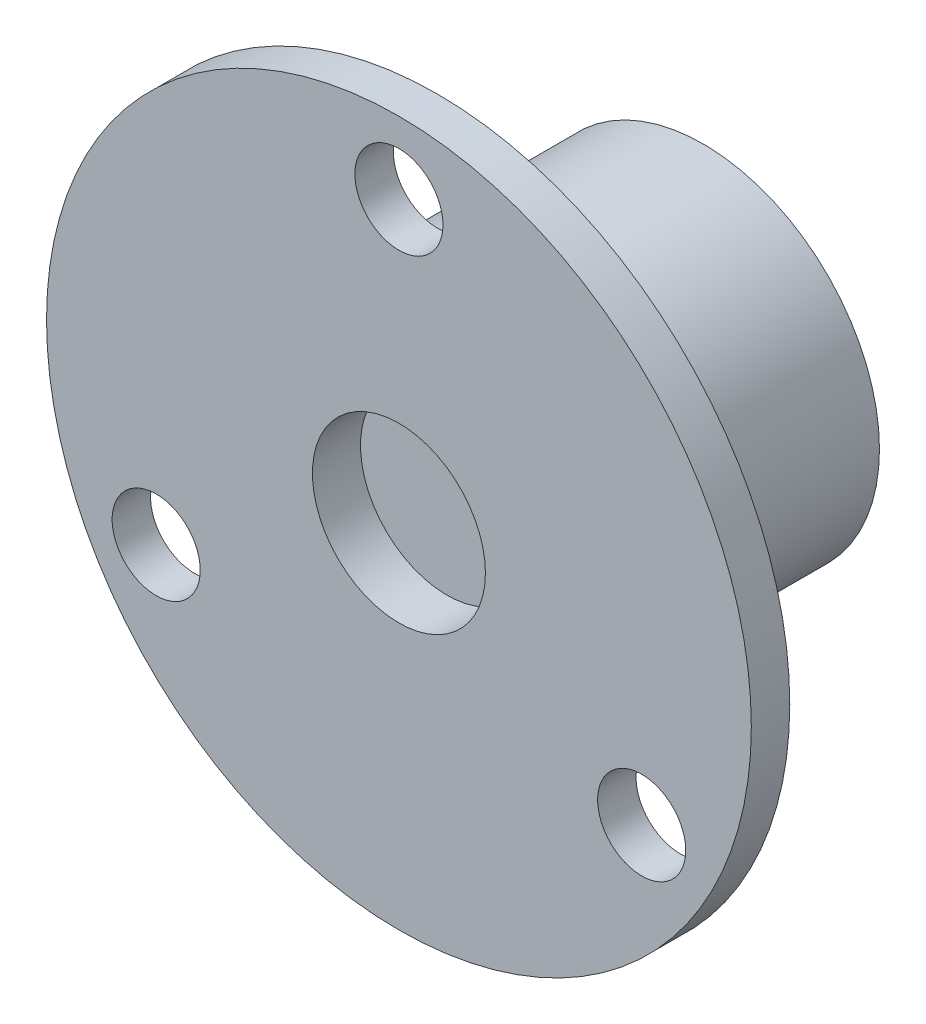
from build123d import *

# Parameters (mm, degrees)
SKETCH1_R           = 22
SKETCH1_R_2         = 11
BOSS_EXTRUDE1_DEPTH = 2.4
SKETCH2_R           = 2.75
CUT_EXTRUDE1_DEPTH  = 32.205127784
BOSS_EXTRUDE4_START = -19
SKETCH4_R           = 11
BOSS_EXTRUDE4_DEPTH = 19
SKETCH6_R           = 5.4
CUT_EXTRUDE2_DEPTH  = 3


with BuildPart() as part:
    # Sketch1 → Boss-Extrude1 (new body)
    with BuildSketch(Plane.XY):
        Circle(SKETCH1_R)
        Circle(SKETCH1_R_2, mode=Mode.SUBTRACT)
    extrude(amount=BOSS_EXTRUDE1_DEPTH)

    # Sketch2 → Cut-Extrude1 (cut, through all)
    with BuildSketch(Plane.XY.offset(2.4)):
        with Locations((0, 17.5)):
            Circle(SKETCH2_R)
        with Locations((15.155444566, -8.75)):
            Circle(SKETCH2_R)
        with Locations((-15.155444566, -8.75)):
            Circle(SKETCH2_R)
    extrude(amount=-CUT_EXTRUDE1_DEPTH, mode=Mode.SUBTRACT)

    # Sketch4 → Boss-Extrude4 (add)
    with BuildSketch(Plane.XY.offset(2.4).offset(BOSS_EXTRUDE4_START)):
        Circle(SKETCH4_R)
    extrude(amount=BOSS_EXTRUDE4_DEPTH)

    # Sketch6 → Cut-Extrude2 (cut)
    with BuildSketch(Plane.XY.offset(2.4)):
        Circle(SKETCH6_R)
    extrude(amount=-CUT_EXTRUDE2_DEPTH, mode=Mode.SUBTRACT)


solid = part.part
